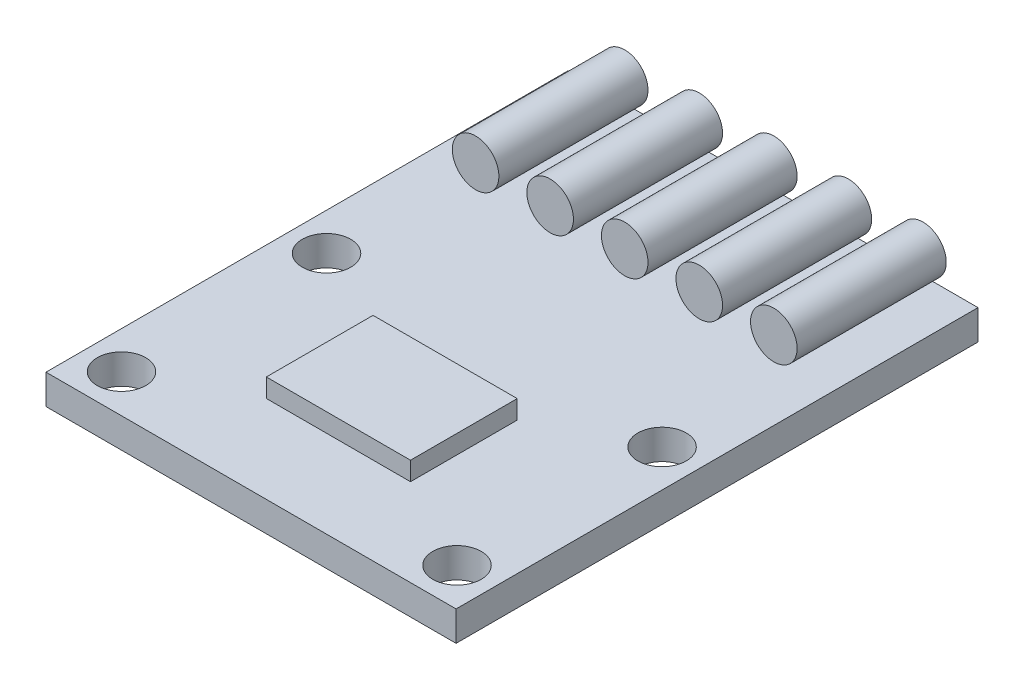
from build123d import *

# Parameters (mm, degrees)
SKETCH1_W             = 22
SKETCH1_H             = 28
BOSS_EXTRUDE1_DEPTH   = 1.6
SKETCH3_R             = 1.3
CUT_EXTRUDE1_DEPTH    = 1.6
SKETCH4_W             = 7.734506334
SKETCH4_H             = 5.725277538
BOSS_EXTRUDE2_DEPTH   = 1
SKETCH6_R             = 1.25
BOSS_EXTRUDE3_DEPTH   = 8
BOSS_EXTRUDE3_2_DEPTH = 8
BOSS_EXTRUDE3_3_DEPTH = 8
BOSS_EXTRUDE3_4_DEPTH = 8
BOSS_EXTRUDE3_5_DEPTH = 8


with BuildPart() as part:
    # Sketch1 → Boss-Extrude1 (new body)
    with BuildSketch(Plane(origin=(0, 0, 0), x_dir=(1, 0, 0), z_dir=(0, 1, 0))):
        Rectangle(SKETCH1_W, SKETCH1_H)
    extrude(amount=BOSS_EXTRUDE1_DEPTH)

    # Sketch3 → Cut-Extrude1 (cut)
    with BuildSketch(Plane(origin=(0, 1.6, 0), x_dir=(1, 0, 0), z_dir=(0, 1, 0))):
        with Locations(Location((9, -11.95, 0), (0, 0, 270))):
            Circle(SKETCH3_R)
        with Locations(Location((9, -0.95, 0), (0, 0, 270))):
            Circle(SKETCH3_R)
        with Locations(Location((-9, -0.95, 0), (0, 0, 270))):
            Circle(SKETCH3_R)
        with Locations(Location((-9, -11.95, 0), (0, 0, 270))):
            Circle(SKETCH3_R)
    extrude(amount=-CUT_EXTRUDE1_DEPTH, mode=Mode.SUBTRACT)

    # Sketch4 → Boss-Extrude2 (add)
    with BuildSketch(Plane(origin=(0, 1.6, 0), x_dir=(1, 0, 0), z_dir=(0, 1, 0))):
        with Locations((0, -6.45)):
            Rectangle(SKETCH4_W, SKETCH4_H)
    extrude(amount=BOSS_EXTRUDE2_DEPTH)


with BuildPart() as body_2:
    # Sketch6 → Boss-Extrude3 (new body)
    with BuildSketch(Plane(origin=(0, 0, -14), x_dir=(-1, 0, 0), z_dir=(0, 0, -1))):
        with Locations((7.953290508, 2.85)):
            Circle(SKETCH6_R)
    extrude(amount=-BOSS_EXTRUDE3_DEPTH)


with BuildPart() as body_3:
    # Sketch6 → Boss-Extrude3 2 (new body)
    with BuildSketch(Plane(origin=(0, 0, -14), x_dir=(-1, 0, 0), z_dir=(0, 0, -1))):
        with Locations((3.953290508, 2.85)):
            Circle(SKETCH6_R)
    extrude(amount=-BOSS_EXTRUDE3_2_DEPTH)


with BuildPart() as body_4:
    # Sketch6 → Boss-Extrude3 3 (new body)
    with BuildSketch(Plane(origin=(0, 0, -14), x_dir=(-1, 0, 0), z_dir=(0, 0, -1))):
        with Locations((-0.046709492, 2.85)):
            Circle(SKETCH6_R)
    extrude(amount=-BOSS_EXTRUDE3_3_DEPTH)


with BuildPart() as body_5:
    # Sketch6 → Boss-Extrude3 4 (new body)
    with BuildSketch(Plane(origin=(0, 0, -14), x_dir=(-1, 0, 0), z_dir=(0, 0, -1))):
        with Locations((-4.046709492, 2.85)):
            Circle(SKETCH6_R)
    extrude(amount=-BOSS_EXTRUDE3_4_DEPTH)


with BuildPart() as body_6:
    # Sketch6 → Boss-Extrude3 5 (new body)
    with BuildSketch(Plane(origin=(0, 0, -14), x_dir=(-1, 0, 0), z_dir=(0, 0, -1))):
        with Locations((-8.046709492, 2.85)):
            Circle(SKETCH6_R)
    extrude(amount=-BOSS_EXTRUDE3_5_DEPTH)


solid = Compound([part.part, body_2.part, body_3.part, body_4.part, body_5.part, body_6.part])
